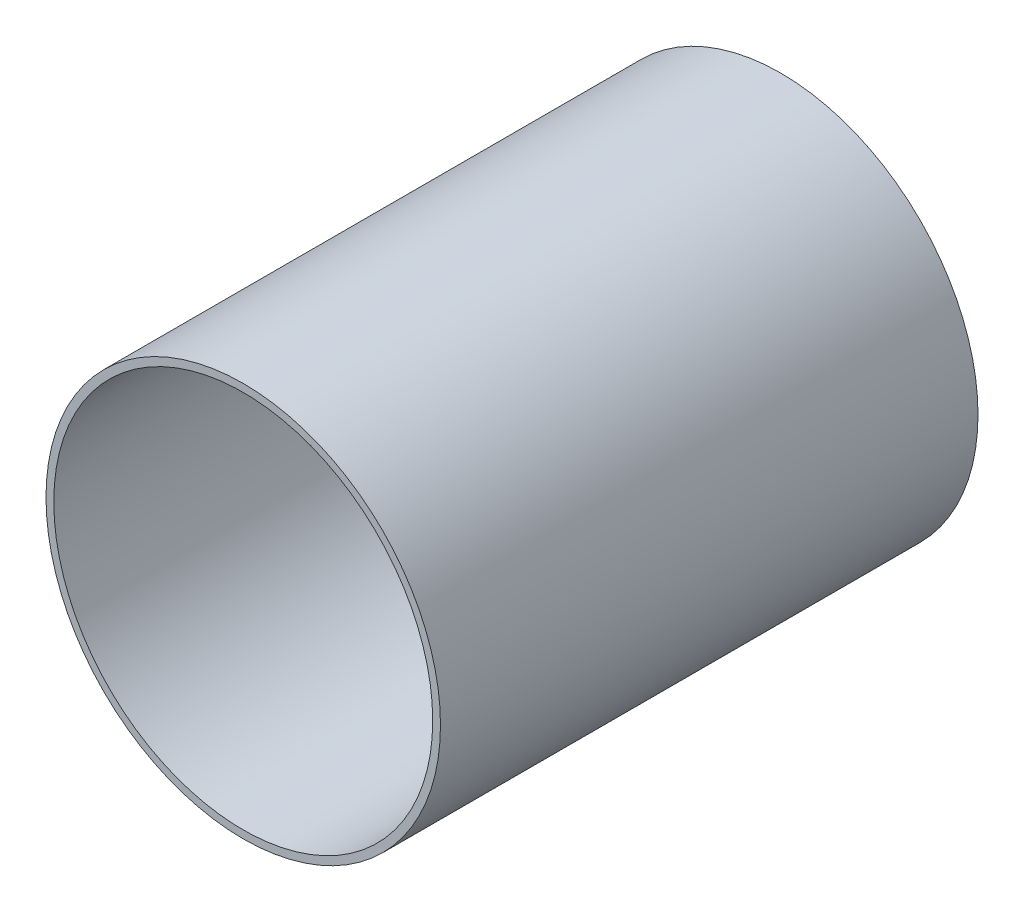
from build123d import *

# Parameters (mm, degrees)
SKETCH1_R      = 22.2
SKETCH1_R_2    = 21.325
BASEPIPE_DEPTH = 30.25


with BuildPart() as part:
    # Sketch1 → BasePipe (new, symmetric)
    with BuildSketch(Plane.XY):
        Circle(SKETCH1_R)
        Circle(SKETCH1_R_2, mode=Mode.SUBTRACT)
    extrude(amount=BASEPIPE_DEPTH, both=True)


solid = part.part
